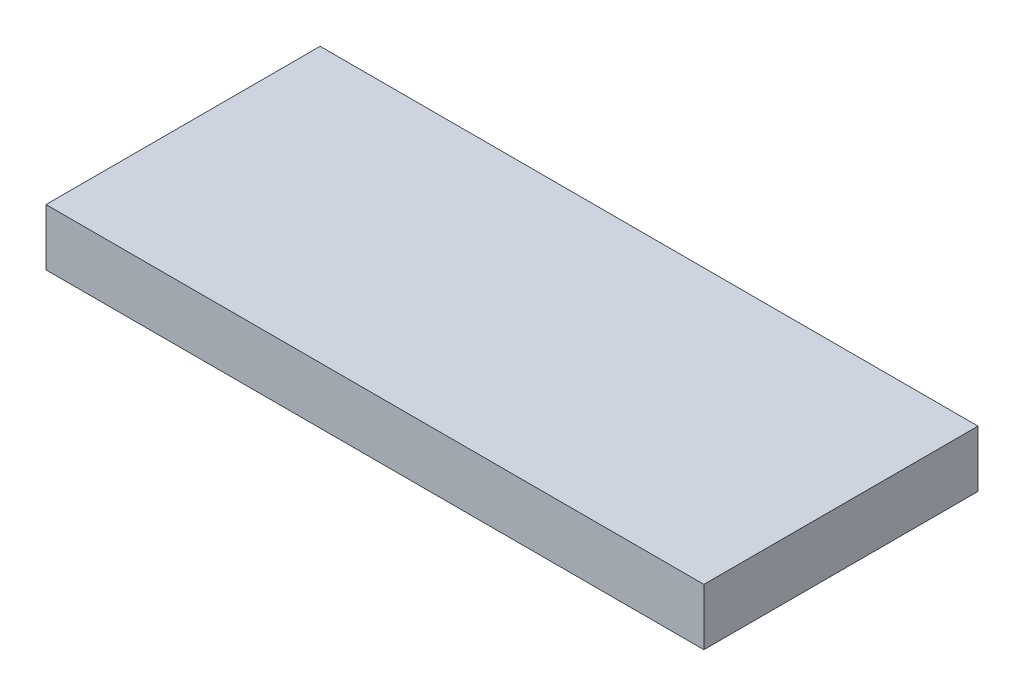
from build123d import *

# Parameters (mm, degrees)
ESQUISSE1_W        = 372
ESQUISSE1_H        = 155
BOSS_EXTRU_1_DEPTH = 32


with BuildPart() as part:
    # Esquisse1 → Boss.-Extru.1 (new body)
    with BuildSketch(Plane(origin=(0, 0, 0), x_dir=(1, 0, 0), z_dir=(0, 1, 0))):
        Rectangle(ESQUISSE1_W, ESQUISSE1_H)
    extrude(amount=BOSS_EXTRU_1_DEPTH)


solid = part.part
